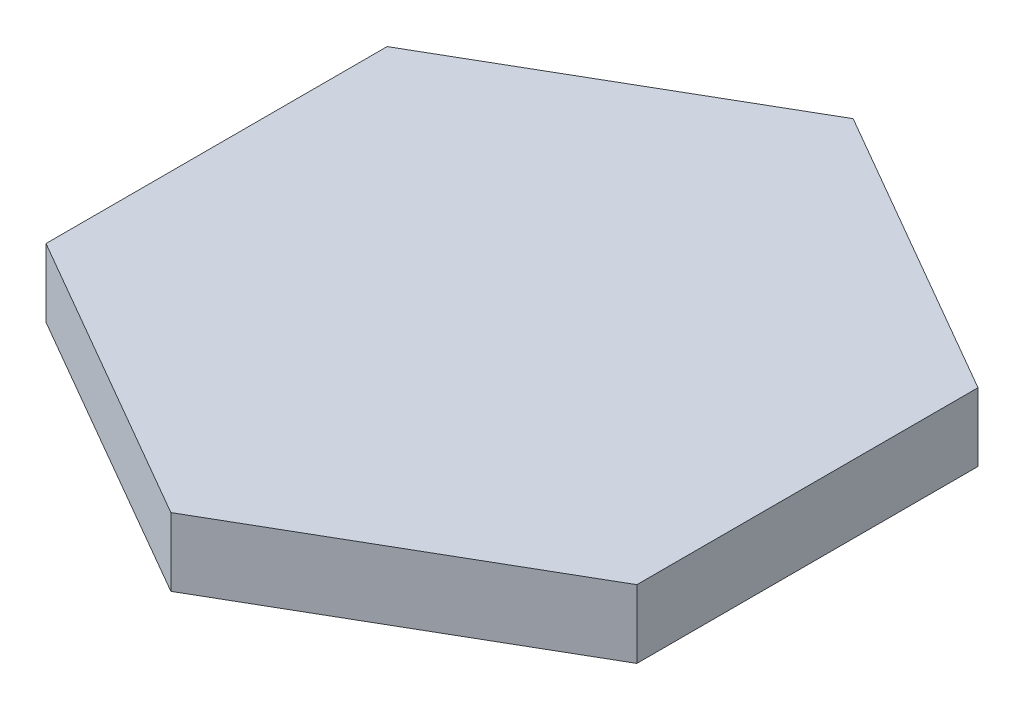
from build123d import *

# Parameters (mm, degrees)
BOSS_EXTRUDE1_DEPTH = 6.35


with BuildPart() as part:
    # Sketch1 → Boss-Extrude1 (new body)
    with BuildSketch(Plane(origin=(0, 0, 0), x_dir=(1, 0, 0), z_dir=(0, 1, 0))):
        Polygon((27.49630657, 15.875), (0, 31.75), (-27.49630657, 15.875), (-27.49630657, -15.875), (0, -31.75), (27.49630657, -15.875), align=None)
    extrude(amount=-BOSS_EXTRUDE1_DEPTH)


solid = part.part
